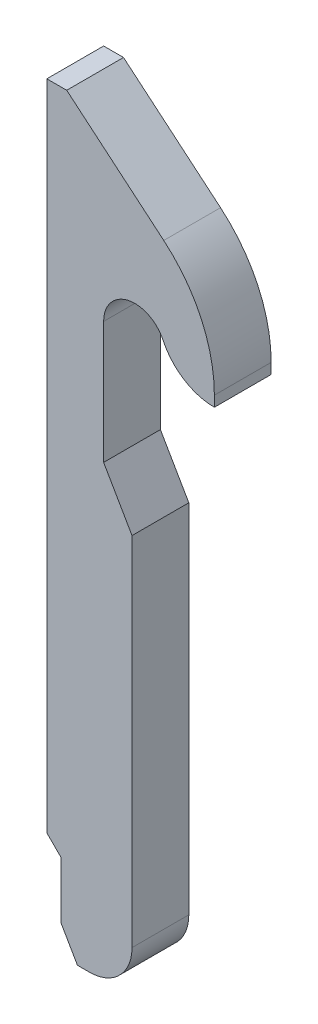
from build123d import *

# Parameters (mm, degrees)
BOSS_EXTRUDE1_DEPTH = 10


with BuildPart() as part:
    # Sketch1 → Boss-Extrude1 (new, symmetric)
    with BuildSketch(Plane.XY):
        with BuildLine():
            Line((5, 10), (10.773502692, 0))
            Line((10.773502692, 0), (15, 0))
            ThreePointArc((15, 0), (25.606601718, 4.393398282), (30, 15))
            Line((30, 15), (30, 140.679491924))
            Line((30, 140.679491924), (20, 158))
            Line((20, 158), (20, 201))
            ThreePointArc((20, 201), (28.580322602, 211.73057134), (40.935483871, 205.720821989))
            ThreePointArc((40.935483871, 205.720821989), (48.315110065, 197.397534592), (59, 194.304134696))
            Line((59, 194.304134696), (59, 198))
            ThreePointArc((59, 198), (54.324714747, 219.11090318), (41.173190677, 236.273826587))
            Line((41.173190677, 236.273826587), (7, 265))
            Line((7, 265), (0, 265))
            Line((0, 265), (0, 35))
            Line((0, 35), (5, 30))
            Line((5, 30), (5, 10))
        make_face()
    extrude(amount=BOSS_EXTRUDE1_DEPTH, both=True)


solid = part.part
